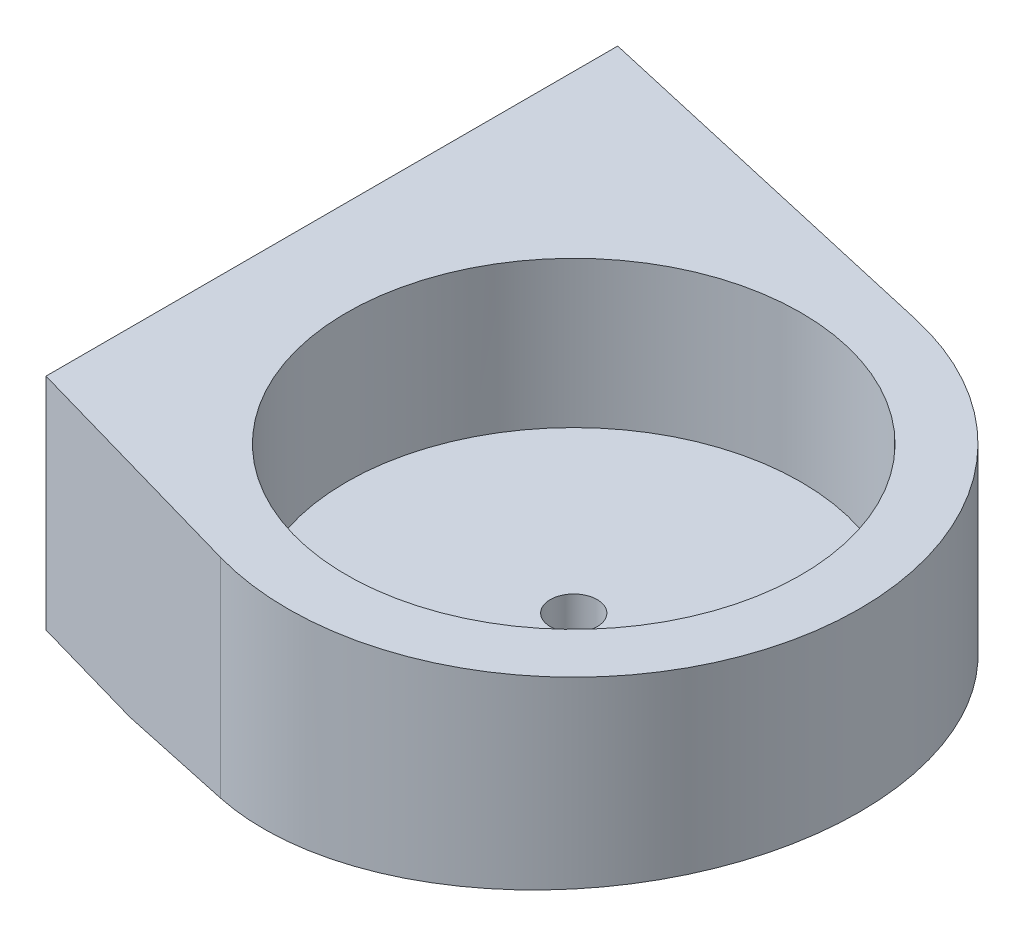
from build123d import *

# Parameters (mm, degrees)
SKETCH1_R               = 15.5
BOSS_EXTRUDE1_DEPTH     = 5
SKETCH2_R               = 15.5
BOSS_EXTRUDE2_DEPTH     = 15
CUT_EXTRUDE7_DEPTH      = 37.523964735
CUT_EXTRUDE7_DEPTH_BACK = 37.523964735
SKETCH18_R              = 1.6
CUT_EXTRUDE8_DEPTH      = 35.770677301
SKETCH19_R              = 2.05
CUT_EXTRUDE9_DEPTH      = 6
CUT_EXTRUDE10_REACH     = 37.749
SKETCH20_R              = 4


with BuildPart() as part:
    # Sketch1 → Boss-Extrude1 (new body)
    with BuildSketch(Plane(origin=(0, 0, 0), x_dir=(1, 0, 0), z_dir=(0, 1, 0))):
        with Locations(Location((0, 0, 0), (0, 0, 270))):
            Circle(SKETCH1_R)
    extrude(amount=BOSS_EXTRUDE1_DEPTH)

    # Sketch2 → Boss-Extrude2 (add)
    with BuildSketch(Plane.XZ):
        with BuildLine():
            Line((-22, -25), (4.323483194, -19.014665211))
            ThreePointArc((4.323483194, -19.014665211), (18.889988887, 4.839247858), (-5.351429285, 18.751325409))
            Line((-5.351429285, 18.751325409), (-22, 14))
            Line((-22, 14), (-22, -25))
        make_face()
        with Locations(Location((0, 0, 0), (0, 0, 270))):
            Circle(SKETCH2_R, mode=Mode.SUBTRACT)
    extrude(amount=-BOSS_EXTRUDE2_DEPTH)

    # Sketch17 → Cut-Extrude7 (cut, two sides: drawn at the far end of the back side and taken through both)
    with BuildSketch(Plane.XY.offset(-CUT_EXTRUDE7_DEPTH_BACK)):
        Polygon((19.5, 0), (-14, 0), (19.5, 3), align=None)
    extrude(amount=CUT_EXTRUDE7_DEPTH + CUT_EXTRUDE7_DEPTH_BACK, mode=Mode.SUBTRACT)

    # Sketch18 → Cut-Extrude8 (cut, through all)
    with BuildSketch(Plane(origin=(0, 5, 0), x_dir=(1, 0, 0), z_dir=(0, 1, 0))):
        with Locations(Location((0, 0, 0), (0, 0, 270))):
            Circle(SKETCH18_R)
    extrude(amount=-CUT_EXTRUDE8_DEPTH, mode=Mode.SUBTRACT)

    # Sketch19 → Cut-Extrude9 (cut)
    with BuildSketch(Plane.XZ):
        with Locations(Location((-18, -5.5, 0), (0, 0, 270))):
            Circle(SKETCH19_R)
    extrude(amount=-CUT_EXTRUDE9_DEPTH, mode=Mode.SUBTRACT)

    # Cut-Extrude10: up to this plane
    cut_extrude10_end = Plane(origin=(-0.111381215, 1.243756906, -24), z_dir=(0.08919529754965995, -0.9960141559712029, 0))
    # Sketch20 → Cut-Extrude10 (cut, up to the surface)
    with BuildSketch(Plane(origin=(0, 2, 0), x_dir=(1, 0, 0), z_dir=(0, 1, 0)), mode=Mode.PRIVATE) as cut_extrude10_sk1:
        with Locations(Location((0, 0, 0), (0, 0, 270))):
            Circle(SKETCH20_R)
    cut_extrude10_tool1 = split(extrude(cut_extrude10_sk1.sketch, amount=-CUT_EXTRUDE10_REACH, mode=Mode.PRIVATE), bisect_by=cut_extrude10_end, keep=Keep.BOTH, mode=Mode.PRIVATE)
    add(cut_extrude10_tool1.solids().sort_by_distance((0, 2, 0))[0], mode=Mode.SUBTRACT)


solid = part.part
